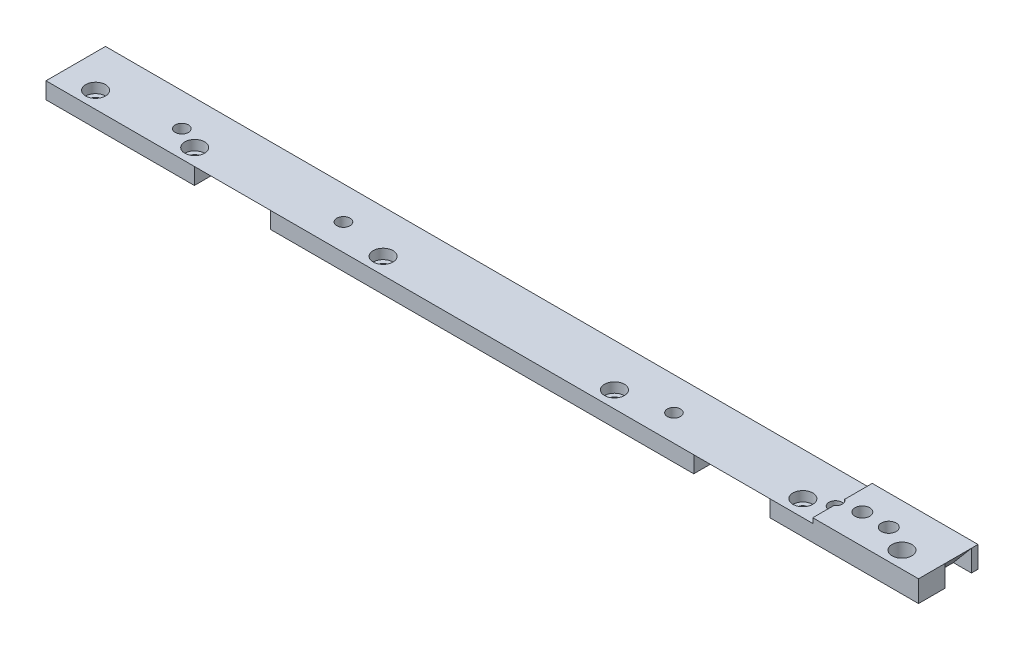
from build123d import *

# Parameters (mm, degrees)
SKIZZE1_W                       = 264
SKIZZE1_H                       = 18
SKIZZE1_R                       = 1.65
SKIZZE1_R_2                     = 2.25
SKIZZE1_R_3                     = 2
AUFSATZ_LINEAR_AUSTRAGEN1_DEPTH = 5
SCHNITT_LINEAR_START            = -2
SCHNITT_LINEAR_AUSTRAGEN1_DEPTH = 8
SCHNITT_LINEAR_START_2          = -44.9
SCHNITT_LINEAR_AUSTRAGEN2_DEPTH = 23.1
SCHNITT_LINEAR_AUSTRAGEN3_DEPTH = 23.1
SKIZZE5_R                       = 3
SCHNITT_LINEAR_AUSTRAGEN4_DEPTH = 3
SKIZZE7_W                       = 32
SKIZZE7_H                       = 18
SKIZZE7_R                       = 2.25
SKIZZE7_R_2                     = 3
AUFSATZ_LINEAR_AUSTRAGEN3_DEPTH = 1.5
AUFSATZ_LINEAR_START            = -5
SKIZZE8_R                       = 2.25
AUFSATZ_LINEAR_AUSTRAGEN4_DEPTH = 5
SCHNITT_LINEAR_AUSTRAGEN6_DEPTH = 8
SKIZZE10_R                      = 2
SCHNITT_LINEAR_AUSTRAGEN7_DEPTH = 1.5


with BuildPart() as part:
    # Skizze1 → Aufsatz-Linear austragen1 (new body)
    with BuildSketch(Plane(origin=(0, 0, 0), x_dir=(1, 0, 0), z_dir=(0, 1, 0))):
        with Locations((132, 9)):
            Rectangle(SKIZZE1_W, SKIZZE1_H)
        with Locations(Location((10, 5, 0), (0, 0, 270))):
            Circle(SKIZZE1_R, mode=Mode.SUBTRACT)
        with Locations(Location((40, 5, 0), (0, 0, 270))):
            Circle(SKIZZE1_R, mode=Mode.SUBTRACT)
        with Locations(Location((26, 9, 0), (0, 0, 270))):
            Circle(SKIZZE1_R_2, mode=Mode.SUBTRACT)
        with Locations(Location((18, 9, 0), (0, 0, 270))):
            Circle(SKIZZE1_R_2, mode=Mode.SUBTRACT)
        with Locations(Location((224, 5, 0), (0, 0, 90))):
            Circle(SKIZZE1_R, mode=Mode.SUBTRACT)
        with Locations(Location((254, 5, 0), (0, 0, 90))):
            Circle(SKIZZE1_R, mode=Mode.SUBTRACT)
        with Locations(Location((246, 9, 0), (0, 0, 90))):
            Circle(SKIZZE1_R_2, mode=Mode.SUBTRACT)
        with Locations(Location((238, 9, 0), (0, 0, 90))):
            Circle(SKIZZE1_R_2, mode=Mode.SUBTRACT)
        with Locations(Location((230.9, 8, 0), (0, 0, 90))):
            Circle(SKIZZE1_R_3, mode=Mode.SUBTRACT)
        with Locations(Location((33.1, 8, 0), (0, 0, 270))):
            Circle(SKIZZE1_R_3, mode=Mode.SUBTRACT)
        with Locations(Location((97, 5, 0), (0, 0, 270))):
            Circle(SKIZZE1_R, mode=Mode.SUBTRACT)
        with Locations(Location((167, 5, 0), (0, 0, 270))):
            Circle(SKIZZE1_R, mode=Mode.SUBTRACT)
        with Locations(Location((82, 8, 0), (0, 0, 270))):
            Circle(SKIZZE1_R_3, mode=Mode.SUBTRACT)
        with Locations(Location((182, 8, 0), (0, 0, 270))):
            Circle(SKIZZE1_R_3, mode=Mode.SUBTRACT)
    extrude(amount=AUFSATZ_LINEAR_AUSTRAGEN1_DEPTH)

    # Skizze2 → Schnitt-Linear austragen1 (cut)
    with BuildSketch(Plane(origin=(0, 0, -18), x_dir=(-1, 0, 0), z_dir=(0, 0, -1)).offset(SCHNITT_LINEAR_START)):
        Polygon((-4.195498156, 0), (0, 0), (0, 5), align=None)
        Polygon((-264, 0), (-259.804501844, 0), (-264, 5), align=None)
    extrude(amount=-SCHNITT_LINEAR_AUSTRAGEN1_DEPTH, mode=Mode.SUBTRACT)

    # Skizze3 → Schnitt-Linear austragen2 (cut)
    with BuildSketch(Plane.ZY.offset(SCHNITT_LINEAR_START_2)):
        Polygon((0, 5), (-5, 0), (0, 0), align=None)
    extrude(amount=-SCHNITT_LINEAR_AUSTRAGEN2_DEPTH, mode=Mode.SUBTRACT)

    # Skizze4 → Schnitt-Linear austragen3 (cut)
    with BuildSketch(Plane(origin=(264, 0, 0), x_dir=(0, 0, -1), z_dir=(1, 0, 0)).offset(SCHNITT_LINEAR_START_2)):
        Polygon((0, 5), (5, 0), (0, 0), align=None)
    extrude(amount=-SCHNITT_LINEAR_AUSTRAGEN3_DEPTH, mode=Mode.SUBTRACT)

    # Skizze5 → Schnitt-Linear austragen4 (cut)
    with BuildSketch(Plane(origin=(0, 5, 0), x_dir=(1, 0, 0), z_dir=(0, 1, 0))):
        with Locations(Location((254, 5, 0), (0, 0, 270))):
            Circle(SKIZZE5_R)
        with Locations(Location((224, 5, 0), (0, 0, 270))):
            Circle(SKIZZE5_R)
        with Locations(Location((40, 5, 0), (0, 0, 270))):
            Circle(SKIZZE5_R)
        with Locations(Location((10, 5, 0), (0, 0, 270))):
            Circle(SKIZZE5_R)
        with Locations(Location((97, 5, 0), (0, 0, 270))):
            Circle(SKIZZE5_R)
        with Locations(Location((167, 5, 0), (0, 0, 270))):
            Circle(SKIZZE5_R)
    extrude(amount=-SCHNITT_LINEAR_AUSTRAGEN4_DEPTH, mode=Mode.SUBTRACT)

    # Skizze7 → Aufsatz-Linear austragen3 (add)
    with BuildSketch(Plane(origin=(0, 5, 0), x_dir=(1, 0, 0), z_dir=(0, 1, 0))):
        with Locations((248, 9)):
            Rectangle(SKIZZE7_W, SKIZZE7_H)
        with Locations(Location((238, 9, 0), (0, 0, 90))):
            Circle(SKIZZE7_R, mode=Mode.SUBTRACT)
        with Locations(Location((246, 9, 0), (0, 0, 90))):
            Circle(SKIZZE7_R, mode=Mode.SUBTRACT)
        with Locations(Location((254, 5, 0), (0, 0, 270))):
            Circle(SKIZZE7_R_2, mode=Mode.SUBTRACT)
    extrude(amount=AUFSATZ_LINEAR_AUSTRAGEN3_DEPTH)

    # Skizze8 → Aufsatz-Linear austragen4 (add)
    with BuildSketch(Plane(origin=(0, 5, 0), x_dir=(1, 0, 0), z_dir=(0, 1, 0)).offset(AUFSATZ_LINEAR_START)):
        with Locations((18, 9)):
            Circle(SKIZZE8_R)
        with Locations((26, 9)):
            Circle(SKIZZE8_R)
    extrude(amount=AUFSATZ_LINEAR_AUSTRAGEN4_DEPTH)

    # Skizze9 → Schnitt-Linear austragen6 (cut)
    with BuildSketch(Plane(origin=(0, 0, -18), x_dir=(-1, 0, 0), z_dir=(0, 0, -1)).offset(SCHNITT_LINEAR_START)):
        Polygon((-264, 6.5), (-264, 0), (-258.545852397, 0), align=None)
    extrude(amount=-SCHNITT_LINEAR_AUSTRAGEN6_DEPTH, mode=Mode.SUBTRACT)

    # Skizze10 → Schnitt-Linear austragen7 (cut)
    with BuildSketch(Plane(origin=(0, 5, 0), x_dir=(1, 0, 0), z_dir=(0, 1, 0))):
        with Locations(Location((230.9, 8, 0), (0, 0, 90))):
            Circle(SKIZZE10_R)
    extrude(amount=SCHNITT_LINEAR_AUSTRAGEN7_DEPTH, mode=Mode.SUBTRACT)


solid = part.part
